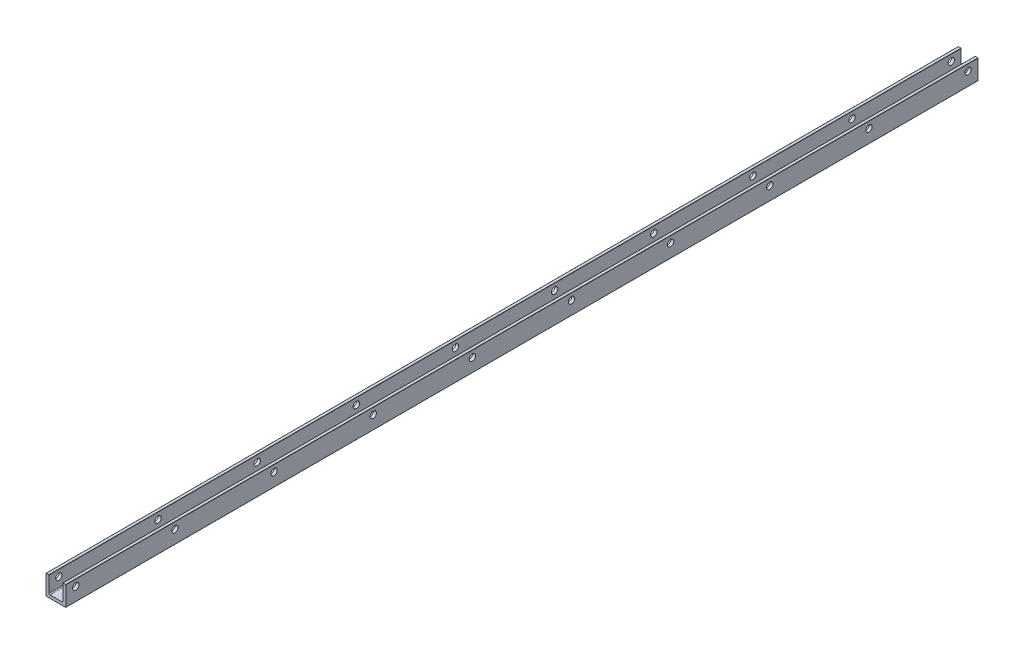
from build123d import *

# Parameters (mm, degrees)
BOSS_EXTRUDE1_DEPTH = 460
FILLET1_R           = 0.5
FILLET2_R           = 0.1
SKETCH2_R           = 1.6
CUT_EXTRUDE1_DEPTH  = 461.21733996
SKETCH4_R           = 2.7
CUT_EXTRUDE2_DEPTH  = 461.135849505


with BuildPart() as part:
    # Sketch1 → Boss-Extrude1 (new body)
    with BuildSketch(Plane.XY):
        Polygon((-5, 0), (5, 0), (5, 10), (3.5, 10), (3.5, 1.5), (-3.5, 1.5), (-3.5, 10), (-5, 10), align=None)
    extrude(amount=BOSS_EXTRUDE1_DEPTH)

    # Fillet1
    fillet1_edges = [part.edges().sort_by_distance(p)[0] for p in [
        (-3.5, 1.5, 230),
        (3.5, 1.5, 230),
    ]]
    fillet(fillet1_edges, radius=FILLET1_R)

    # Fillet2
    fillet2_edges = [part.edges().sort_by_distance(p)[0] for p in [
        (5, 0, 230),
        (-5, 0, 230),
        (-5, 10, 230),
        (-3.5, 10, 230),
        (3.5, 10, 230),
        (5, 10, 230),
    ]]
    fillet(fillet2_edges, radius=FILLET2_R)

    # Sketch2 → Cut-Extrude1 (cut, through all)
    with BuildSketch(Plane.ZY.offset(5)):
        with Locations((5, 6.7)):
            Circle(SKETCH2_R)
        with Locations((55, 6.7)):
            Circle(SKETCH2_R)
        with Locations((105, 6.7)):
            Circle(SKETCH2_R)
        with Locations((155, 6.7)):
            Circle(SKETCH2_R)
        with Locations((205, 6.7)):
            Circle(SKETCH2_R)
        with Locations((255, 6.7)):
            Circle(SKETCH2_R)
        with Locations((305, 6.7)):
            Circle(SKETCH2_R)
        with Locations((355, 6.7)):
            Circle(SKETCH2_R)
        with Locations((405, 6.7)):
            Circle(SKETCH2_R)
        with Locations((455, 6.7)):
            Circle(SKETCH2_R)
        with Locations((505, 6.7)):
            Circle(SKETCH2_R)
    extrude(amount=-CUT_EXTRUDE1_DEPTH, mode=Mode.SUBTRACT)

    # Sketch4 → Cut-Extrude2 (cut, through all)
    with BuildSketch(Plane.XZ):
        with Locations(Location((0, 30, 0), (0, 0, 270))):
            Circle(SKETCH4_R)
    extrude(amount=-CUT_EXTRUDE2_DEPTH, mode=Mode.SUBTRACT)


solid = part.part
